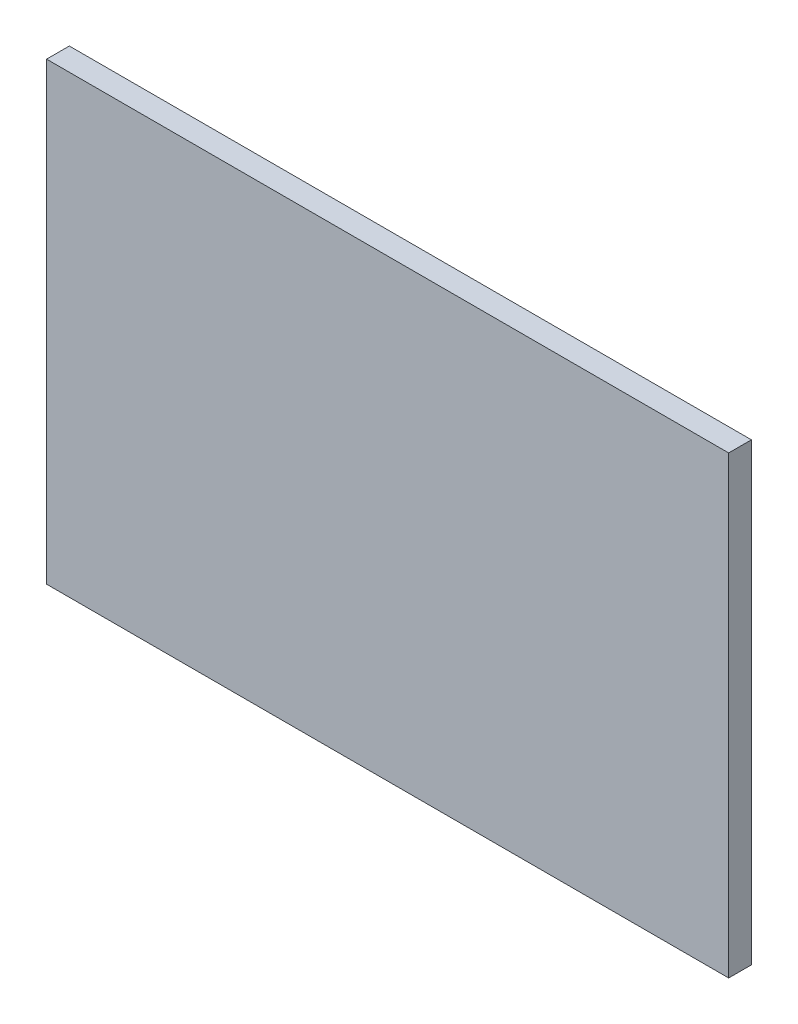
from build123d import *


with BuildPart() as part:
    # Skizze1 → Ausformung2 section 0
    with BuildSketch(Plane.XY):
        with BuildLine():
            Line((-15, 10), (-15, -10))
            Line((-15, -10), (15, -10))
            Line((15, -10), (15, 10))
            Line((15, 10), (-15, 10))
        make_face()
    # Skizze2 → Ausformung2 section 1
    with BuildSketch(Plane(origin=(0, 0, 1), x_dir=(-1, 0, 0), z_dir=(0, 0, -1))):
        with BuildLine():
            Line((15, 10), (15, -10))
            Line((15, -10), (-15, -10))
            Line((-15, -10), (-15, 10))
            Line((-15, 10), (15, 10))
        make_face()
    loft()


solid = part.part
